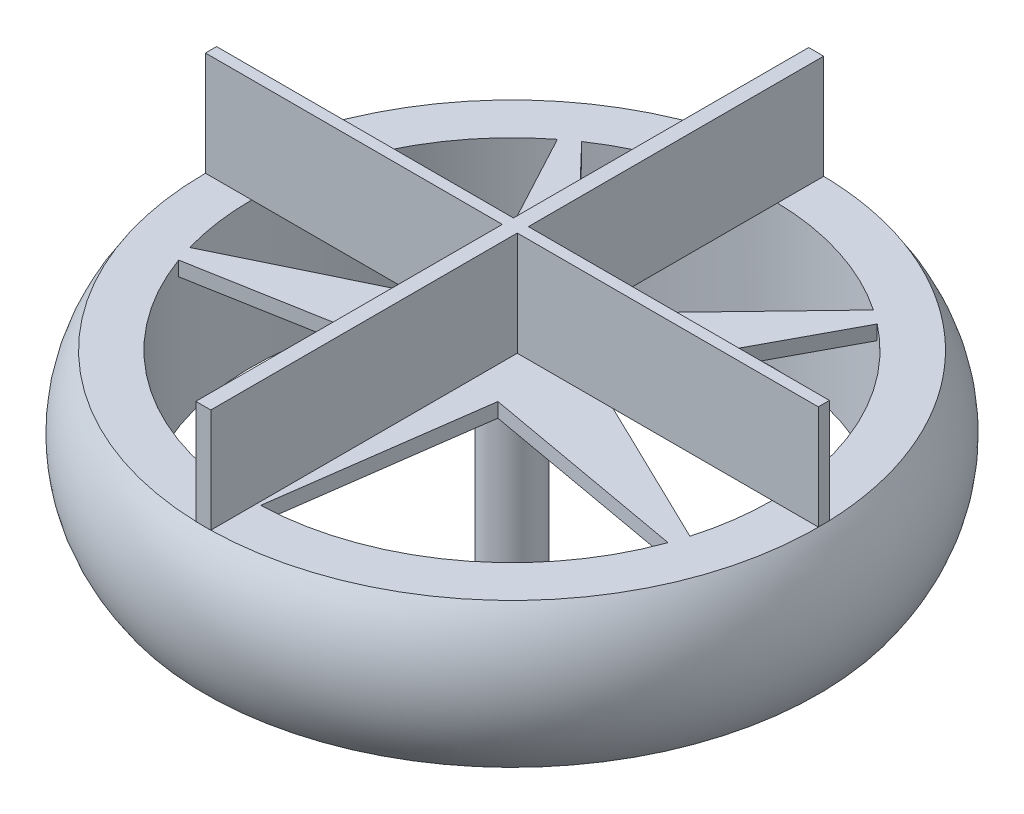
from build123d import *

# Parameters (mm, degrees)
BOSS_EXTRUDE3_DEPTH = 2.5
BOSS_EXTRUDE4_DEPTH = 29
SKETCH4_W           = 2.589054973
SKETCH4_H           = 105.965654802
SKETCH4_W_2         = 105.965002317
SKETCH4_H_2         = 1.925754282
BOSS_EXTRUDE5_DEPTH = 18


with BuildPart() as part:
    # Sketch1 → Revolve1 (revolve)
    with BuildSketch(Plane.YZ, mode=Mode.PRIVATE) as revolve1_sk:
        with BuildLine():
            Line((0, 45), (25, 45))
            Line((25, 45), (25, 53))
            ThreePointArc((25, 53), (12.5, 57), (0, 53))
            Line((0, 53), (0, 45))
        make_face()
    revolve(revolve1_sk.sketch.rotate(Axis((0, 0, 0), (0, 1, 0)), 180), axis=Axis((0, 0, 0), (0, 1, 0)))

    # Sketch2 → Boss-Extrude3 (add)
    with BuildSketch(Plane(origin=(0, 25, 0), x_dir=(-1, 0, 0), z_dir=(0, 1, 0))):
        with BuildLine():
            Line((42.797543233, 13.905764747), (0, 0))
            Line((0, 0), (0, 44.974993052))
            Line((0, 44.974993052), (0, 45))
            ThreePointArc((0, 45), (-0.750104217, 44.993747829), (-1.5, 44.974993052))
            Line((-1.5, 44.974993052), (-6.465637775, 8.899186938))
            Line((-6.465637775, 8.899186938), (-42.310234721, 15.324621949))
            ThreePointArc((-42.310234721, 15.324621949), (-42.797543233, 13.905764747), (-43.237285704, 12.4714524))
            Line((-43.237285704, 12.4714524), (-10.461621679, -3.399186938))
            Line((-10.461621679, -3.399186938), (-27.649163129, -35.503855822))
            ThreePointArc((-27.649163129, -35.503855822), (-26.450336353, -36.405764747), (-25.222112146, -37.267211579))
            Line((-25.222112146, -37.267211579), (0, -11))
            Line((0, -11), (25.222112146, -37.267211579))
            ThreePointArc((25.222112146, -37.267211579), (26.450336353, -36.405764747), (27.649163129, -35.503855822))
            Line((27.649163129, -35.503855822), (10.461621679, -3.399186938))
            Line((10.461621679, -3.399186938), (43.237285704, 12.4714524))
            ThreePointArc((43.237285704, 12.4714524), (43.023392016, 13.190441216), (42.797543233, 13.905764747))
        make_face()
        with BuildLine():
            Line((6.465637775, 8.899186938), (0, 0))
            Line((0, 0), (42.797543233, 13.905764747))
            ThreePointArc((42.797543233, 13.905764747), (42.559802114, 14.617224223), (42.310234721, 15.324621949))
            Line((42.310234721, 15.324621949), (6.465637775, 8.899186938))
        make_face()
        Polygon((0, 44.974993052), (0, 0), (6.465637775, 8.899186938), (1.5, 44.974993052), align=None)
        with BuildLine():
            Line((0, 45), (0, 44.974993052))
            Line((0, 44.974993052), (1.5, 44.974993052))
            ThreePointArc((1.5, 44.974993052), (0.750104217, 44.993747829), (0, 45))
        make_face()
    extrude(amount=-BOSS_EXTRUDE3_DEPTH)

    # Sketch3 → Boss-Extrude4 (add)
    with BuildSketch(Plane.XZ.offset(-22.5)):
        with BuildLine():
            Line((1.75, 4.145780988), (1.75, 2.436698586))
            ThreePointArc((1.75, 2.436698586), (2.669269563, 1.369306394), (3, 0))
            ThreePointArc((3, 0), (2.669269563, -1.369306394), (1.75, -2.436698586))
            Line((1.75, -2.436698586), (1.75, -4.145780988))
            ThreePointArc((1.75, -4.145780988), (3.75, -2.487468593), (4.5, 0))
            ThreePointArc((4.5, 0), (3.75, 2.487468593), (1.75, 4.145780988))
        make_face()
        with BuildLine():
            ThreePointArc((3, 0), (2.669269563, 1.369306394), (1.75, 2.436698586))
            Line((1.75, 2.436698586), (1.75, 0))
            Line((1.75, 0), (1.75, -2.436698586))
            ThreePointArc((1.75, -2.436698586), (2.669269563, -1.369306394), (3, 0))
        make_face()
        with BuildLine():
            Line((-1.75, -2.436698586), (-1.75, 0))
            Line((-1.75, 0), (-1.75, 2.436698586))
            ThreePointArc((-1.75, 2.436698586), (-3, 0), (-1.75, -2.436698586))
        make_face()
        with BuildLine():
            ThreePointArc((-1.75, -2.436698586), (-3, 0), (-1.75, 2.436698586))
            Line((-1.75, 2.436698586), (-1.75, 4.145780988))
            ThreePointArc((-1.75, 4.145780988), (-4.5, 0), (-1.75, -4.145780988))
            Line((-1.75, -4.145780988), (-1.75, -2.436698586))
        make_face()
        with BuildLine():
            Line((-1.75, 4.145780988), (-1.75, 2.436698586))
            ThreePointArc((-1.75, 2.436698586), (0, 3), (1.75, 2.436698586))
            Line((1.75, 2.436698586), (1.75, 4.145780988))
            ThreePointArc((1.75, 4.145780988), (0, 4.5), (-1.75, 4.145780988))
        make_face()
        with BuildLine():
            ThreePointArc((1.75, -2.436698586), (0, -3), (-1.75, -2.436698586))
            Line((-1.75, -2.436698586), (-1.75, -4.145780988))
            ThreePointArc((-1.75, -4.145780988), (0, -4.5), (1.75, -4.145780988))
            Line((1.75, -4.145780988), (1.75, -2.436698586))
        make_face()
    extrude(amount=BOSS_EXTRUDE4_DEPTH)

    # Sketch4 → Boss-Extrude5 (add)
    with BuildSketch(Plane(origin=(0, 25, 0), x_dir=(-1, 0, 0), z_dir=(0, 1, 0))):
        with Locations((0.379622384, 0.0092753)):
            Rectangle(SKETCH4_W, SKETCH4_H)
        with Locations((0.017498841, -0.962877141)):
            Rectangle(SKETCH4_W_2, SKETCH4_H_2)
    extrude(amount=BOSS_EXTRUDE5_DEPTH)


solid = part.part
